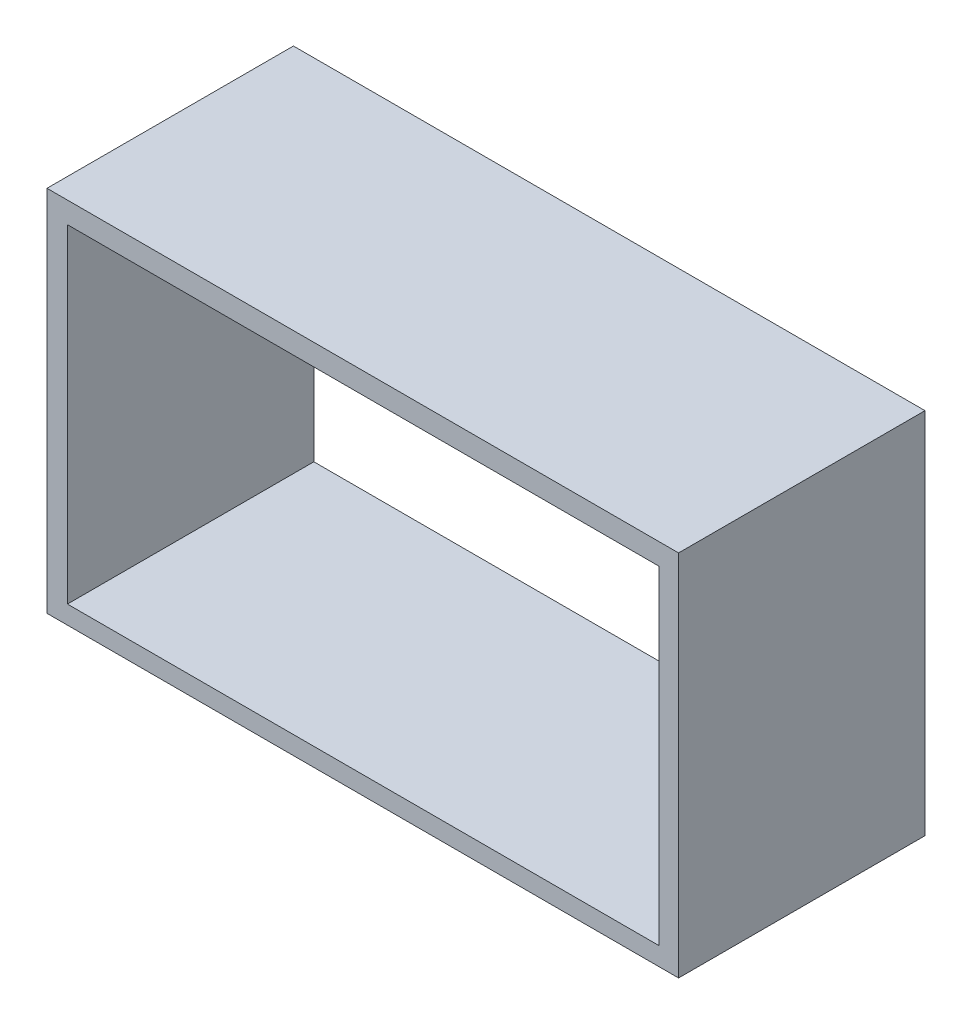
from build123d import *

# Parameters (mm, degrees)
SKETCH1_W           = 38.444593688
SKETCH1_H           = 22.408115129
SKETCH1_W_2         = 36
SKETCH1_H_2         = 20
BOSS_EXTRUDE4_DEPTH = 15


with BuildPart() as part:
    # Sketch1 → Boss-Extrude4 (new body)
    with BuildSketch(Plane.XY):
        with Locations((8.866651169, 2.091105506)):
            Rectangle(SKETCH1_W, SKETCH1_H)
        with Locations((8.888128108, 1.99881672)):
            Rectangle(SKETCH1_W_2, SKETCH1_H_2, mode=Mode.SUBTRACT)
    extrude(amount=BOSS_EXTRUDE4_DEPTH)


solid = part.part
